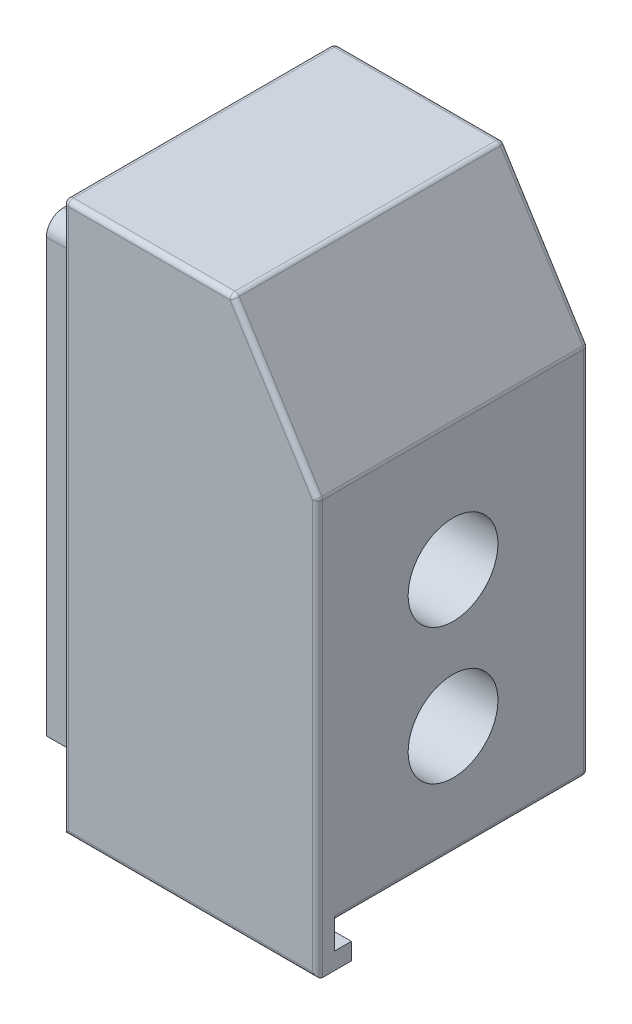
from build123d import *

# Parameters (mm, degrees)
BOSS_EXTRUDE1_DEPTH = 16
BOSS_EXTRUDE2_DEPTH = 15
SKETCH4_R           = 2.65
CUT_EXTRUDE1_DEPTH  = 38.161808352
SKETCH6_W           = 14
SKETCH6_H           = 26.5
BOSS_EXTRUDE4_DEPTH = 2
FILLET3_R           = 1
FILLET4_R           = 0.3


with BuildPart() as part:
    # Sketch1 → Boss-Extrude1 (new body)
    with BuildSketch(Plane.XY):
        Polygon((0, 0), (0, 30), (10, 30), (15, 22), (15, 0), align=None)
    extrude(amount=BOSS_EXTRUDE1_DEPTH)

    # Sketch3 → Boss-Extrude2 (add)
    with BuildSketch(Plane(origin=(15, 0, 0), x_dir=(0, 0, -1), z_dir=(1, 0, 0))):
        Polygon((-16, 0), (-16, -2.5), (-14, -2.5), (-14, -1.5), (-15, -1.5), (-15, 0), align=None)
    extrude(amount=-BOSS_EXTRUDE2_DEPTH)

    # Sketch4 → Cut-Extrude1 (cut, through all)
    with BuildSketch(Plane(origin=(15, 0, 0), x_dir=(0, 0, -1), z_dir=(1, 0, 0))):
        with Locations(Location((-8, 14.5, 0), (0, 0, 90))):
            Circle(SKETCH4_R)
        with Locations(Location((-8, 6.5, 0), (0, 0, 90))):
            Circle(SKETCH4_R)
    extrude(amount=-CUT_EXTRUDE1_DEPTH, mode=Mode.SUBTRACT)

    # Fillet4
    fillet4_edges = [part.edges().sort_by_distance(p)[0] for p in [
        (12.5, 26, 16),
        (5, 30, 16),
        (0, 13.75, 16),
        (15, 0, 7.5),
        (7.5, -2.5, 16),
        (0, 15, 0),
        (5, 30, 0),
        (12.5, 26, 0),
        (15, 11, 0),
        (7.5, 0, 0),
        (15, 9.75, 16),
        (0, 30, 8),
        (10, 30, 8),
        (15, 22, 8),
    ]]
    fillet(fillet4_edges, radius=FILLET4_R)


with BuildPart() as body_2:
    # Sketch6 → Boss-Extrude4 (new body)
    with BuildSketch(Plane.ZY):
        with Locations((8, 14.25)):
            Rectangle(SKETCH6_W, SKETCH6_H)
    extrude(amount=BOSS_EXTRUDE4_DEPTH)

    # Fillet3
    fillet3_edges = [body_2.edges().sort_by_distance(p)[0] for p in [
        (-1, 27.5, 1),
        (-1, 27.5, 15),
    ]]
    fillet(fillet3_edges, radius=FILLET3_R)


solid = Compound([part.part, body_2.part])
